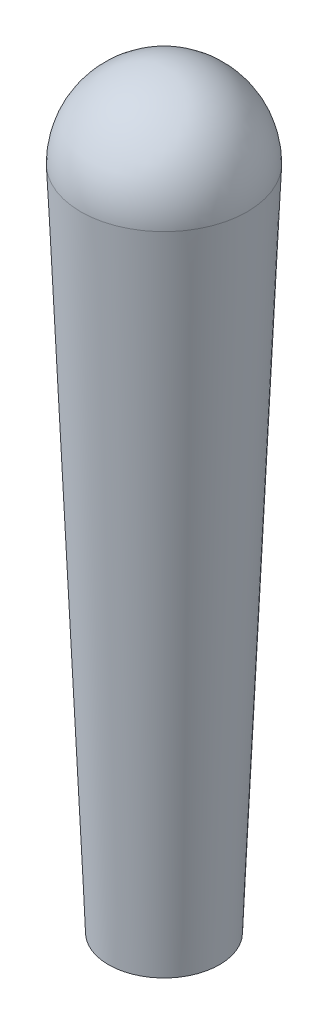
from build123d import *

# Parameters (mm, degrees)
SKETCH1_R = 1
SKETCH2_R = 1.5


with BuildPart() as part:
    # Sketch1 → Loft1 section 0
    with BuildSketch(Plane(origin=(0, 0, 0), x_dir=(1, 0, 0), z_dir=(0, 1, 0))):
        Circle(SKETCH1_R)
    # Sketch2 → Loft1 section 1
    with BuildSketch(Plane(origin=(0, 12, 0), x_dir=(1, 0, 0), z_dir=(0, 1, 0))):
        Circle(SKETCH2_R)
    loft()

    # Sketch3 → Revolve1 (revolve)
    with BuildSketch(Plane.XY, mode=Mode.PRIVATE) as revolve1_sk:
        with BuildLine():
            Line((0, 12), (1.5, 12))
            ThreePointArc((1.5, 12), (1.060660172, 13.060660172), (0, 13.5))
            Line((0, 13.5), (0, 12))
        make_face()
    revolve(revolve1_sk.sketch.rotate(Axis((0, 0, 0), (0, 1, 0)), 270), axis=Axis((0, 0, 0), (0, 1, 0)))


solid = part.part
